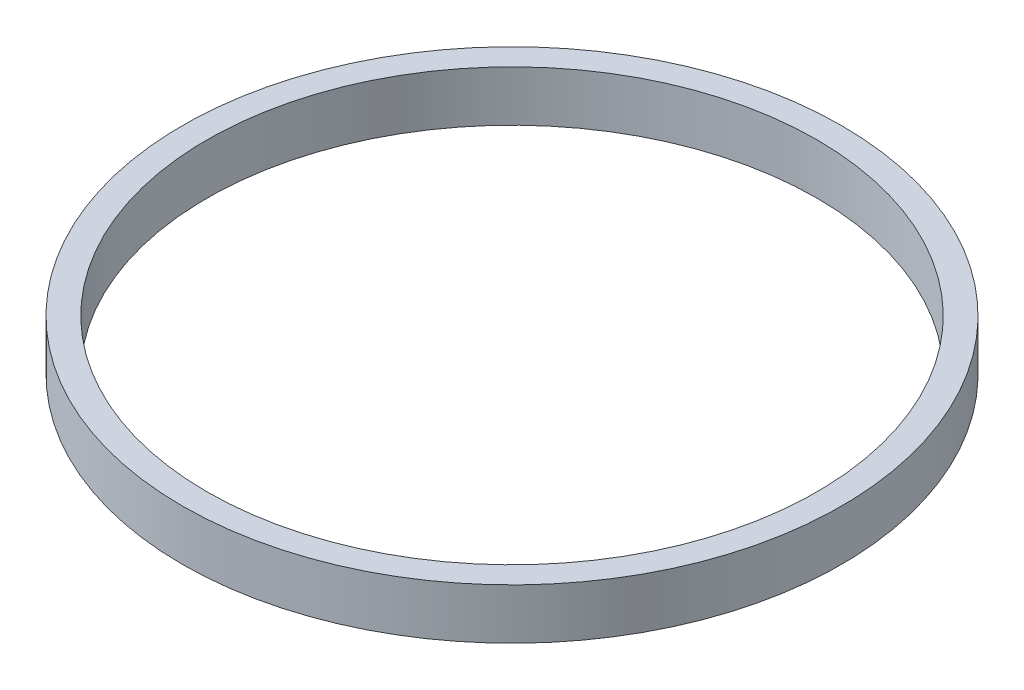
from build123d import *

# Parameters (mm, degrees)
CROQUIS1_R              = 32.6
CROQUIS1_R_2            = 30.165
SALIENTE_EXTRUIR1_DEPTH = 5


with BuildPart() as part:
    # Croquis1 → Saliente-Extruir1 (new body)
    with BuildSketch(Plane(origin=(0, 0, 0), x_dir=(1, 0, 0), z_dir=(0, 1, 0))):
        with Locations(Location((0, 0, 0), (0, 0, 270))):
            Circle(CROQUIS1_R)
        with Locations(Location((0, 0, 0), (0, 0, 270))):
            Circle(CROQUIS1_R_2, mode=Mode.SUBTRACT)
    extrude(amount=SALIENTE_EXTRUIR1_DEPTH)


solid = part.part
